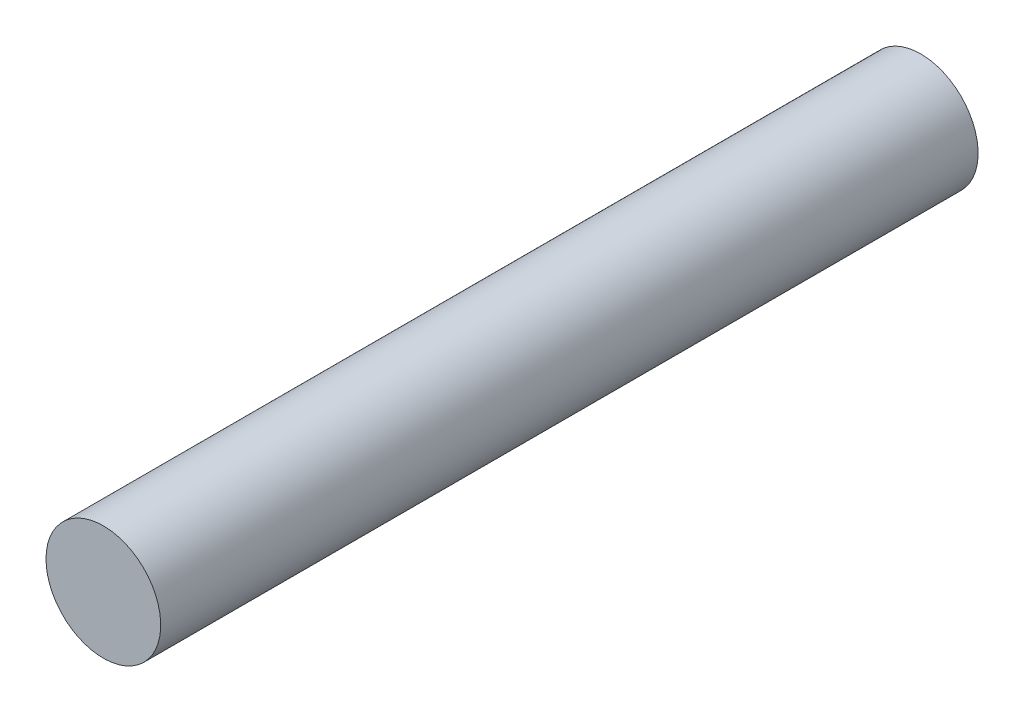
from build123d import *

# Parameters (mm, degrees)
SKETCH1_R           = 4
BOSS_EXTRUDE1_DEPTH = 57


with BuildPart() as part:
    # Sketch1 → Boss-Extrude1 (new body)
    with BuildSketch(Plane.XY):
        with Locations(Location((0, 0, 0), (0, 0, 180))):
            Circle(SKETCH1_R)
    extrude(amount=BOSS_EXTRUDE1_DEPTH)


solid = part.part
